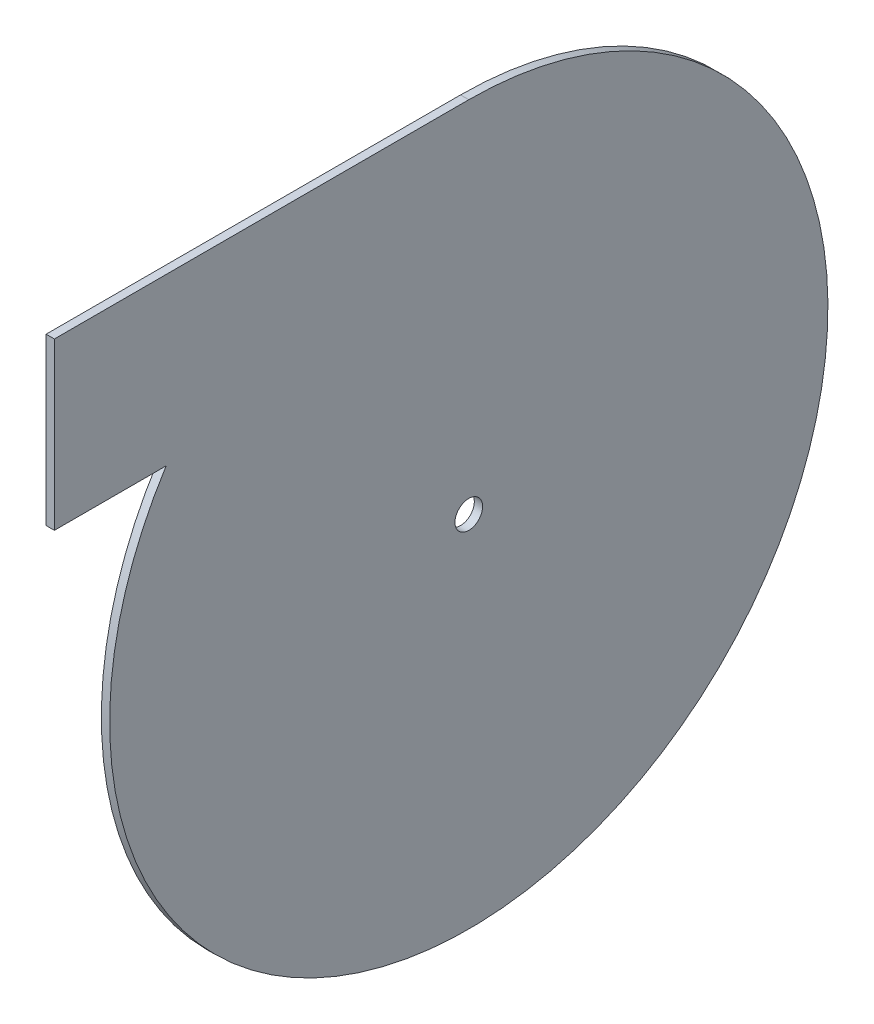
from build123d import *

# Parameters (mm, degrees)
SKETCH1_R           = 5
BOSS_EXTRUDE1_DEPTH = 3


with BuildPart() as part:
    # Sketch1 → Boss-Extrude1 (new body)
    with BuildSketch(Plane(origin=(0, 0, 0), x_dir=(0, 0, -1), z_dir=(1, 0, 0))):
        with BuildLine():
            Line((0, 130), (-150, 130))
            Line((-150, 130), (-150, 70))
            Line((-150, 70), (-109.544511501, 70))
            ThreePointArc((-109.544511501, 70), (62.449979984, -114.01754251), (0, 130))
        make_face()
        Circle(SKETCH1_R, mode=Mode.SUBTRACT)
    extrude(amount=BOSS_EXTRUDE1_DEPTH)


solid = part.part
